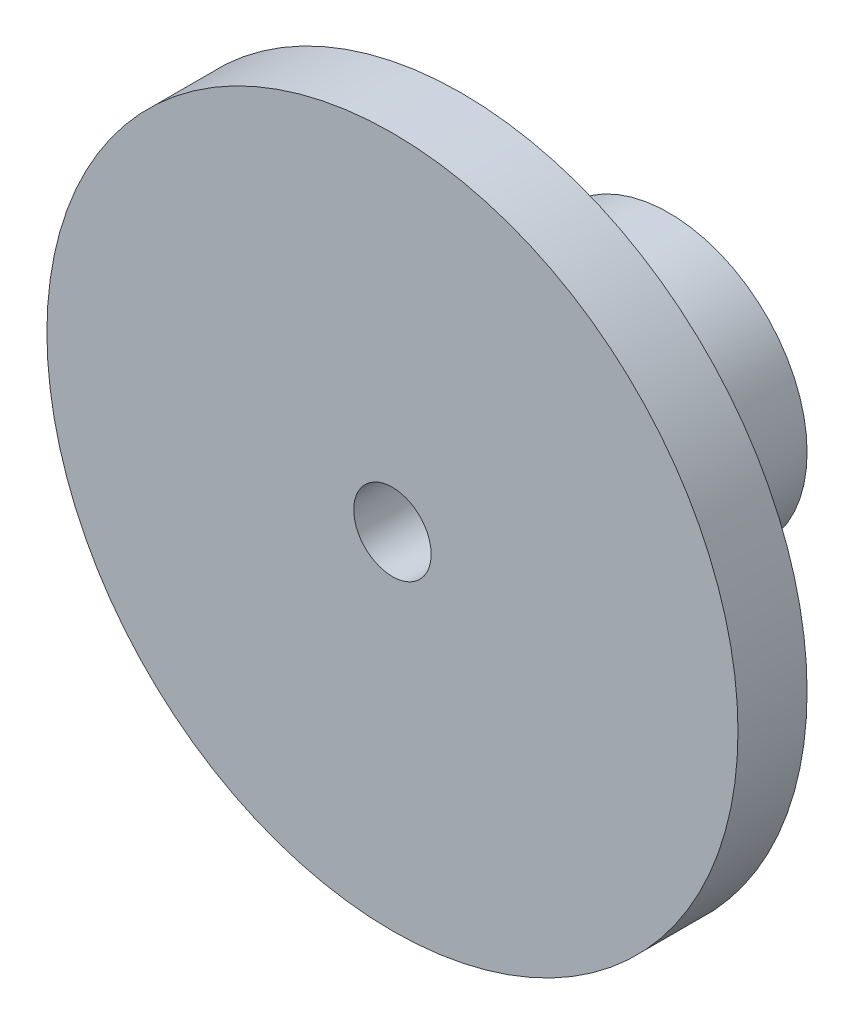
from build123d import *
from build123d.topology import SkipClean

# Parameters (mm, degrees)
ESQUISSE1_R        = 25
ESQUISSE1_R_2      = 2.8
BOSS_EXTRU_1_DEPTH = 5
BOSS_EXTRU_2_START = 15
ESQUISSE2_R        = 10
ESQUISSE2_R_2      = 2.8
BOSS_EXTRU_2_DEPTH = 15


with BuildPart() as part:
    # Esquisse1 → Boss.-Extru.1 (new body)
    with BuildSketch(Plane.XY):
        Circle(ESQUISSE1_R)
        Circle(ESQUISSE1_R_2, mode=Mode.SUBTRACT)
    extrude(amount=BOSS_EXTRU_1_DEPTH)

    # Esquisse2 → Boss.-Extru.2 (add)
    with SkipClean():  # the faces are left unmerged after this step: merging them gives an invalid solid
        with BuildSketch(Plane(origin=(0, 0, 0), x_dir=(-1, 0, 0), z_dir=(0, 0, -1)).offset(BOSS_EXTRU_2_START)):
            with Locations(Location((0, 0, 0), (0, 0, 180))):
                Circle(ESQUISSE2_R)
            Circle(ESQUISSE2_R_2, mode=Mode.SUBTRACT)
        extrude(amount=-BOSS_EXTRU_2_DEPTH)


solid = part.part
